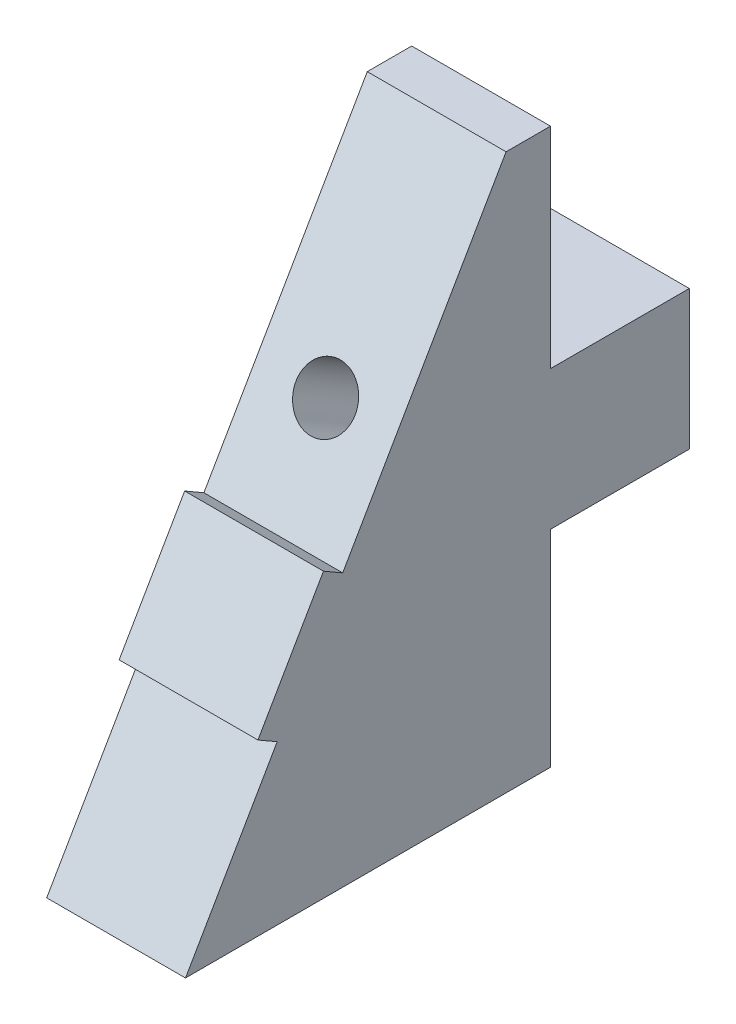
from build123d import *

# Parameters (mm, degrees)
BOSS_EXTRUDE1_DEPTH           = 6.35
SKETCH2_W                     = 6.35
SKETCH2_H                     = 6.5278
BOSS_EXTRUDE2_DEPTH           = 6.35
SKETCH8_W                     = 6.35
SKETCH8_H                     = 6.1722
BOSS_EXTRUDE3_DEPTH           = 1.016
TAP_DRILL_FOR_6_32_TAP1_D     = 2.7051
TAP_DRILL_FOR_6_32_TAP1_DEPTH = 6.35
TAP_DRILL_FOR_6_32_TAP1_TIP   = 0.81269403
SKETCH12_W                    = 6.35
SKETCH12_H                    = 6.35
CUT_EXTRUDE2_DEPTH            = 0.08128
SKETCH13_W                    = 6.35
SKETCH13_H                    = 6.35
CUT_EXTRUDE3_DEPTH            = 0.08128
SKETCH14_W                    = 6.35
SKETCH14_H                    = 1.016
CUT_EXTRUDE4_DEPTH            = 0.0889
SKETCH15_W                    = 6.35
SKETCH15_H                    = 1.016
CUT_EXTRUDE5_DEPTH            = 0.0889


with BuildPart() as part:
    # Sketch1 → Boss-Extrude1 (new body)
    with BuildSketch(Plane(origin=(0, 0, 0), x_dir=(0, 0, -1), z_dir=(1, 0, 0))):
        Polygon((0, 0), (0, 25.4), (-2.032, 25.4), (-16.696696837, 0), align=None)
    extrude(amount=BOSS_EXTRUDE1_DEPTH)

    # Sketch2 → Boss-Extrude2 (add)
    with BuildSketch(Plane(origin=(0, 0, 0), x_dir=(-1, 0, 0), z_dir=(0, 0, -1))):
        with Locations((-3.175, 12.6111)):
            Rectangle(SKETCH2_W, SKETCH2_H)
    extrude(amount=BOSS_EXTRUDE2_DEPTH)

    # Sketch8 → Boss-Extrude3 (add)
    with BuildSketch(Plane(origin=(0, 7.22988181, 12.522522628), x_dir=(1, 0, 0), z_dir=(0, 0.49999999999999467, 0.8660254037844417))):
        with Locations((3.175, 3.035945256)):
            Rectangle(SKETCH8_W, SKETCH8_H)
    extrude(amount=BOSS_EXTRUDE3_DEPTH)

    # Tap Drill for #6-32 Tap1
    with Locations(Plane(origin=(0, 7.22988181, 12.522522628), x_dir=(1, 0, 0), z_dir=(0, 0.49999999999999467, 0.8660254037844417))):
        with Locations((3.175, 10.821045256)):
            Hole(TAP_DRILL_FOR_6_32_TAP1_D / 2, depth=TAP_DRILL_FOR_6_32_TAP1_DEPTH)
            with Locations((0, 0, -(TAP_DRILL_FOR_6_32_TAP1_DEPTH + TAP_DRILL_FOR_6_32_TAP1_TIP / 2))):  # 118° drill point
                Cone(0, TAP_DRILL_FOR_6_32_TAP1_D / 2, TAP_DRILL_FOR_6_32_TAP1_TIP, mode=Mode.SUBTRACT)

    # Sketch12 → Cut-Extrude2 (cut)
    with BuildSketch(Plane(origin=(0, 15.875, 0), x_dir=(1, 0, 0), z_dir=(0, 1, 0))):
        with Locations((3.175, 3.175)):
            Rectangle(SKETCH12_W, SKETCH12_H)
    extrude(amount=-CUT_EXTRUDE2_DEPTH, mode=Mode.SUBTRACT)

    # Sketch13 → Cut-Extrude3 (cut)
    with BuildSketch(Plane.XZ.offset(-9.3472)):
        with Locations((3.175, -3.175)):
            Rectangle(SKETCH13_W, SKETCH13_H)
    extrude(amount=-CUT_EXTRUDE3_DEPTH, mode=Mode.SUBTRACT)

    # Sketch14 → Cut-Extrude4 (cut)
    with BuildSketch(Plane(origin=(0, 5.301846715, -3.061022628), x_dir=(1, 0, 0), z_dir=(0, 0.8660254037844417, -0.49999999999999467))):
        with Locations((3.175, -14.96776362)):
            Rectangle(SKETCH14_W, SKETCH14_H)
    extrude(amount=-CUT_EXTRUDE4_DEPTH, mode=Mode.SUBTRACT)

    # Sketch15 → Cut-Extrude5 (cut)
    with BuildSketch(Plane(origin=(0, -0.043435282, 0.025077372), x_dir=(1, 0, 0), z_dir=(0, -0.8660254037844417, 0.49999999999999467))):
        with Locations((3.175, 14.96776362)):
            Rectangle(SKETCH15_W, SKETCH15_H)
    extrude(amount=-CUT_EXTRUDE5_DEPTH, mode=Mode.SUBTRACT)


solid = part.part
